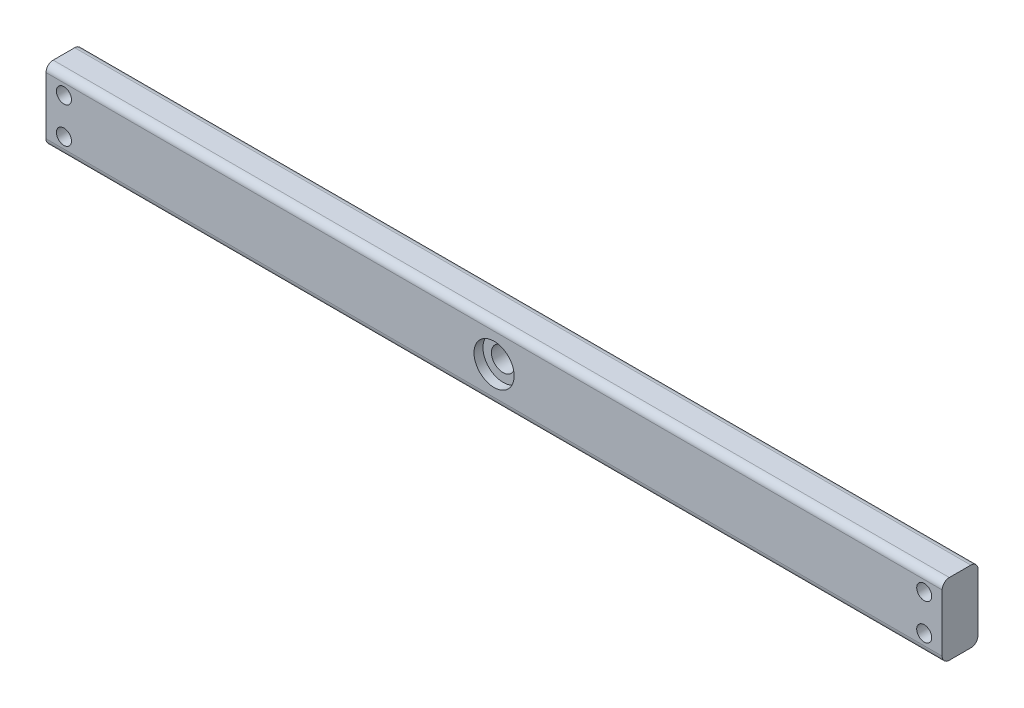
from build123d import *

# Parameters (mm, degrees)
SKETCH_1_W          = 250
SKETCH_1_H          = 20
SKETCH_1_R          = 3.25
EXTRUDE_1_DEPTH     = 5
SKETCH_2_R          = 5.6
CUT_EXTRUDE_1_DEPTH = 2.5
CUT_EXTRUDE_START   = -2.5
SKETCH_3_R          = 5.6
CUT_EXTRUDE_2_DEPTH = 2.5
SKETCH_4_R          = 2.1
CUT_EXTRUDE_3_DEPTH = 126.797456254
FILLET_1_R          = 2


with BuildPart() as part:
    # 草图1 → 凸台-拉伸1 (new, symmetric)
    with BuildSketch(Plane.XY):
        Rectangle(SKETCH_1_W, SKETCH_1_H)
        Circle(SKETCH_1_R, mode=Mode.SUBTRACT)
    extrude(amount=EXTRUDE_1_DEPTH, both=True)

    # 草图2 → 切除-拉伸1 (cut)
    with BuildSketch(Plane(origin=(0, 0, -5), x_dir=(-1, 0, 0), z_dir=(0, 0, -1))):
        Circle(SKETCH_2_R)
    extrude(amount=-CUT_EXTRUDE_1_DEPTH, mode=Mode.SUBTRACT)

    # 草图3 → 切除-拉伸2 (cut)
    with BuildSketch(Plane.XY.offset(5).offset(CUT_EXTRUDE_START)):
        with Locations(Location((0, 0, 0), (0, 0, 180))):
            Circle(SKETCH_3_R)
    extrude(amount=CUT_EXTRUDE_2_DEPTH, mode=Mode.SUBTRACT)

    # 草图4 → 切除-拉伸3 (cut, through all)
    with BuildSketch(Plane.XY.offset(5)):
        with Locations((-120, 5)):
            Circle(SKETCH_4_R)
        with Locations((-120, -5)):
            Circle(SKETCH_4_R)
        with Locations(Location((120, -5, 0), (0, 0, 180))):
            Circle(SKETCH_4_R)
        with Locations(Location((120, 5, 0), (0, 0, 180))):
            Circle(SKETCH_4_R)
    extrude(amount=-CUT_EXTRUDE_3_DEPTH, mode=Mode.SUBTRACT)

    # 圆角1
    fillet_1_edges = [part.edges().sort_by_distance(p)[0] for p in [
        (0, -10, 5),
        (0, -10, -5),
        (0, 10, -5),
        (0, 10, 5),
    ]]
    fillet(fillet_1_edges, radius=FILLET_1_R)


solid = part.part
